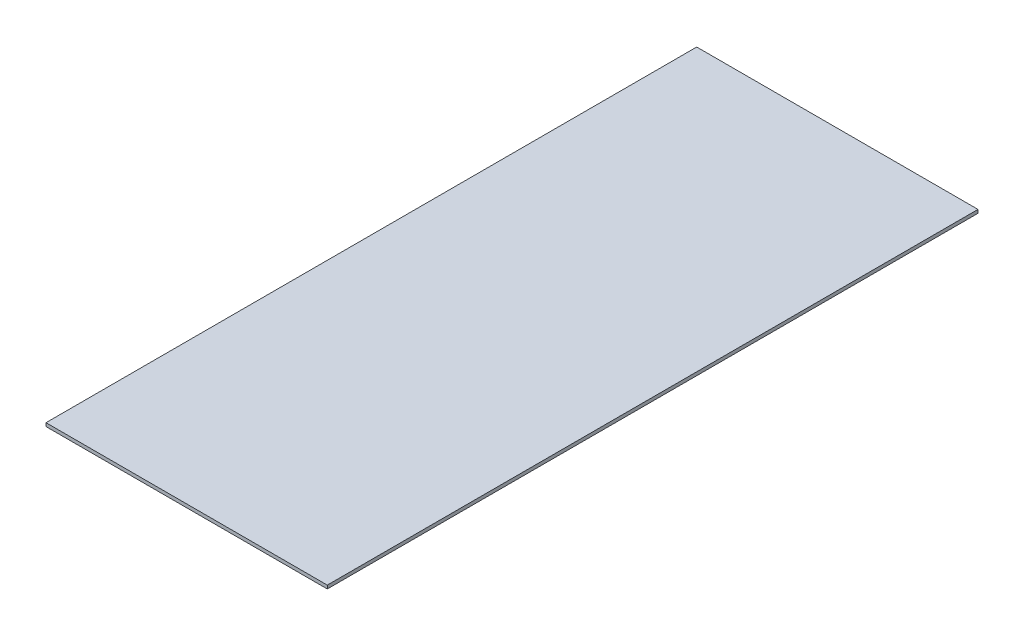
from build123d import *

# Parameters (mm, degrees)
SKETCH1_W           = 1054.1
SKETCH1_H           = 2438.4
BOSS_EXTRUDE1_DEPTH = 12.7


with BuildPart() as part:
    # Sketch1 → Boss-Extrude1 (new body)
    with BuildSketch(Plane(origin=(0, 0, 0), x_dir=(1, 0, 0), z_dir=(0, 1, 0))):
        Rectangle(SKETCH1_W, SKETCH1_H)
    extrude(amount=BOSS_EXTRUDE1_DEPTH)


solid = part.part
